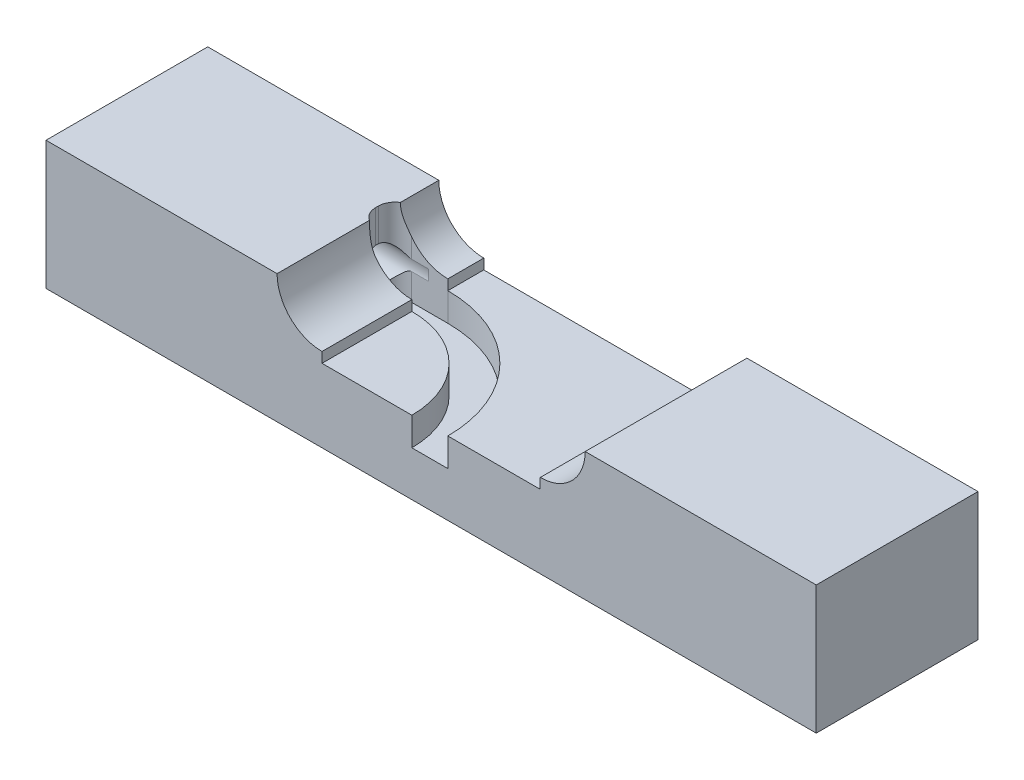
from build123d import *

# Parameters (mm, degrees)
SKETCH1_W               = 38.1
SKETCH1_H               = 8.001
BOSS_EXTRUDE1_DEPTH     = 6.35
CUT_EXTRUDE1_DEPTH      = 25.4
CUT_EXTRUDE2_DEPTH      = 20.898310393
CUT_EXTRUDE2_DEPTH_BACK = 1.905
CUT_EXTRUDE3_START      = -38.1
SKETCH5_R               = 0.9271
CUT_EXTRUDE3_DEPTH      = 12.7
SKETCH6_W               = 10.795
SKETCH6_H               = 8.001
CUT_EXTRUDE4_DEPTH      = 0.508


with BuildPart() as part:
    # Sketch1 → Boss-Extrude1 (new body)
    with BuildSketch(Plane(origin=(0, 0, 0), x_dir=(1, 0, 0), z_dir=(0, 1, 0))):
        Rectangle(SKETCH1_W, SKETCH1_H)
    extrude(amount=BOSS_EXTRUDE1_DEPTH)

    # Sketch2 → Cut-Extrude1 (cut)
    with BuildSketch(Plane(origin=(0, 0, -4.0005), x_dir=(-1, 0, 0), z_dir=(0, 0, -1))):
        with BuildLine():
            Line((5.3975, 4.1275), (-5.3975, 4.1275))
            ThreePointArc((-5.3975, 4.1275), (-7.62, 6.35), (-5.3975, 8.5725))
            Line((-5.3975, 8.5725), (5.3975, 8.5725))
            ThreePointArc((5.3975, 8.5725), (7.62, 6.35), (5.3975, 4.1275))
        make_face()
    extrude(amount=-CUT_EXTRUDE1_DEPTH, mode=Mode.SUBTRACT)

    # Sketch4 → Cut-Extrude2 (cut, two sides: drawn at the far end of the back side and taken through both)
    with BuildSketch(Plane(origin=(0, 4.1275, 0), x_dir=(1, 0, 0), z_dir=(0, 1, 0)).offset(-CUT_EXTRUDE2_DEPTH_BACK)):
        with BuildLine():
            Line((0.8255, -4.0005), (-0.9525, -4.0005))
            ThreePointArc((-0.9525, -4.0005), (-2.254410358, -0.857410358), (-5.3975, 0.4445))
            Line((-5.3975, 0.4445), (-7.185501788, 0.4445))
            ThreePointArc((-7.185501788, 0.4445), (-7.769218436, 0.686283352), (-8.011001788, 1.27))
            Line((-8.011001788, 1.27), (-8.011001788, 1.397))
            ThreePointArc((-8.011001788, 1.397), (-7.769218436, 1.980716648), (-7.185501788, 2.2225))
            Line((-7.185501788, 2.2225), (-5.3975, 2.2225))
            ThreePointArc((-5.3975, 2.2225), (-0.997174501, 0.399825499), (0.8255, -4.0005))
        make_face()
    extrude(amount=CUT_EXTRUDE2_DEPTH + CUT_EXTRUDE2_DEPTH_BACK, mode=Mode.SUBTRACT)

    # Sketch5 → Cut-Extrude3 (cut)
    with BuildSketch(Plane(origin=(19.05, 0, 0), x_dir=(0, 0, -1), z_dir=(1, 0, 0)).offset(CUT_EXTRUDE3_START)):
        with Locations(Location((1.3335, 3.81, 0), (0, 0, 180))):
            Circle(SKETCH5_R)
    extrude(amount=CUT_EXTRUDE3_DEPTH, mode=Mode.SUBTRACT)

    # Sketch6 → Cut-Extrude4 (cut)
    with BuildSketch(Plane(origin=(0, 4.1275, 0), x_dir=(1, 0, 0), z_dir=(0, 1, 0))):
        Rectangle(SKETCH6_W, SKETCH6_H)
    extrude(amount=-CUT_EXTRUDE4_DEPTH, mode=Mode.SUBTRACT)


solid = part.part
